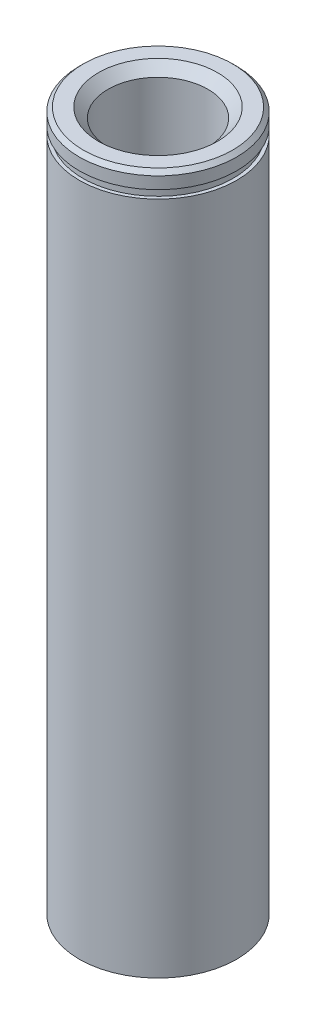
from build123d import *

# Parameters (mm, degrees)
F_5_8_0_625_DIAMETER_HOLE1_D     = 15.875
F_5_8_0_625_DIAMETER_HOLE1_DEPTH = 69.85
F_5_8_0_625_DIAMETER_HOLE1_TIP   = 4.769331164
CHAMFER1_SIZE                    = 0.635
F_8_32_TAPPED_HOLE1_D            = 3.4544
F_8_32_TAPPED_HOLE1_DEPTH        = 12.7
F_8_32_TAPPED_HOLE1_TIP          = 1.037806461
SKETCH8_R                        = 2.368549992
SKETCH8_R_2                      = 2.368549996
SKETCH8_R_3                      = 2.368550008
SKETCH8_R_4                      = 2.368550004
CUT_EXTRUDE1_DEPTH               = 12.7
CHAMFER2_SIZE                    = 1.524


with BuildPart() as part:
    # Sketch1 → Revolve1 (revolve)
    with BuildSketch(Plane(origin=(0, 0, 0), x_dir=(0, 0, -1), z_dir=(1, 0, 0))):
        Polygon((12.500000019, 108.43719994), (11.949999976, 108.43719994), (11.949999976, 107.1372), (12.500000019, 107.1372), (12.500000019, 0), (6.35, 0), (6.35, 110.97719994), (12.500000019, 110.97719994), align=None)
    revolve(axis=Axis((0, 0, 0), (0, 1, 0)))

    # 5/8 (0.625) Diameter Hole1
    with Locations(Plane(origin=(0, 110.97719994, 0), x_dir=(1, 0, 0), z_dir=(0, 1, 0))):
        with Locations((0, 0)):
            Hole(F_5_8_0_625_DIAMETER_HOLE1_D / 2, depth=F_5_8_0_625_DIAMETER_HOLE1_DEPTH)
            with Locations((0, 0, -(F_5_8_0_625_DIAMETER_HOLE1_DEPTH + F_5_8_0_625_DIAMETER_HOLE1_TIP / 2))):  # 118° drill point
                Cone(0, F_5_8_0_625_DIAMETER_HOLE1_D / 2, F_5_8_0_625_DIAMETER_HOLE1_TIP, mode=Mode.SUBTRACT)

    # Chamfer1
    chamfer1_edges = [part.edges().sort_by_distance(p)[0] for p in [
        (0, 110.97719994, 12.500000019),
    ]]
    chamfer(chamfer1_edges, length=CHAMFER1_SIZE)

    # #8-32 Tapped Hole1
    with Locations(Plane(origin=(0, 0, 0), x_dir=(-1, 0, 0), z_dir=(0, -1, 0))):
        with Locations((9.42500001, 0), (0, -9.42500001), (-9.42500001, 0), (0, 9.42500001)):
            Hole(F_8_32_TAPPED_HOLE1_D / 2, depth=F_8_32_TAPPED_HOLE1_DEPTH)
            with Locations((0, 0, -(F_8_32_TAPPED_HOLE1_DEPTH + F_8_32_TAPPED_HOLE1_TIP / 2))):  # 118° drill point
                Cone(0, F_8_32_TAPPED_HOLE1_D / 2, F_8_32_TAPPED_HOLE1_TIP, mode=Mode.SUBTRACT)

    # Sketch8 → Cut-Extrude1 (cut)
    with BuildSketch(Plane.XZ):
        with Locations(Location((6.664481419, 6.664481419, 0), (0, 0, 270))):
            Circle(SKETCH8_R)
        with Locations(Location((6.664481419, -6.664481419, 0), (0, 0, 270))):
            Circle(SKETCH8_R_2)
        with Locations(Location((-6.664481419, -6.664481419, 0), (0, 0, 270))):
            Circle(SKETCH8_R_3)
        with Locations(Location((-6.664481419, 6.664481419, 0), (0, 0, 270))):
            Circle(SKETCH8_R_4)
    extrude(amount=-CUT_EXTRUDE1_DEPTH, mode=Mode.SUBTRACT)

    # Chamfer2
    chamfer2_edges = [part.edges().sort_by_distance(p)[0] for p in [
        (7.9375, 110.97719994, 0),
    ]]
    chamfer(chamfer2_edges, length=CHAMFER2_SIZE)


solid = part.part
